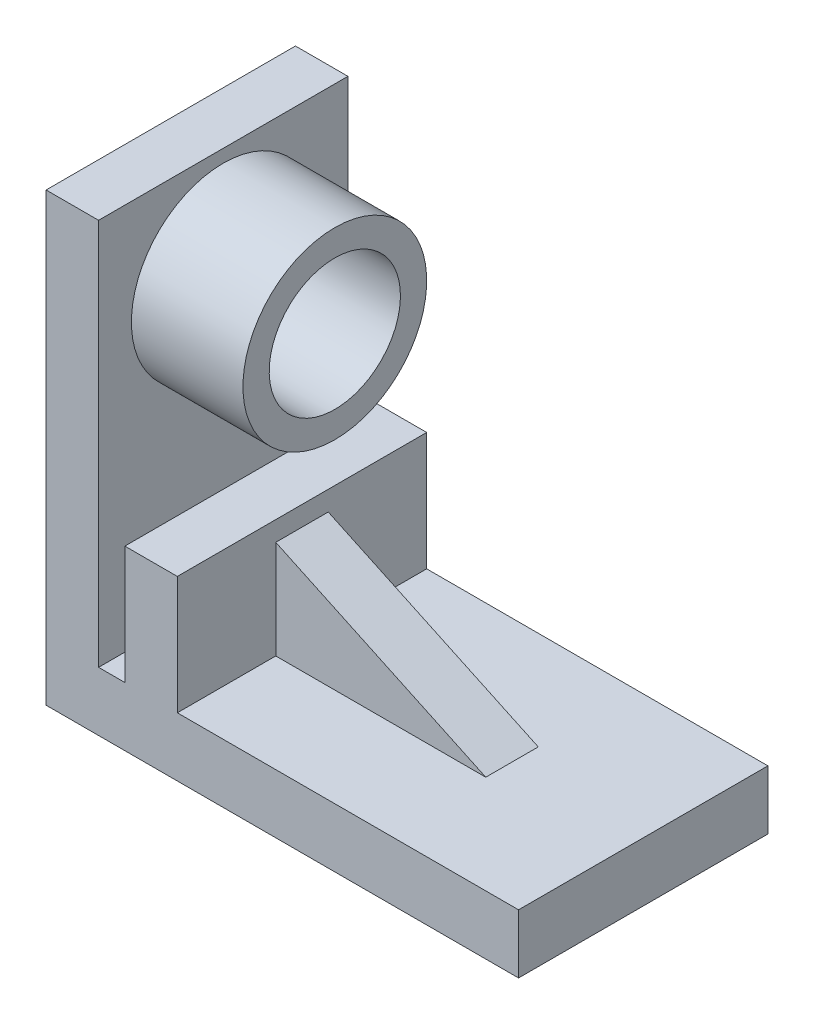
from build123d import *

# Parameters (mm, degrees)
SALIENTE_EXTRUIR2_DEPTH = 19
SALIENTE_EXTRUIR3_DEPTH = 32
CORTAR_EXTRUIR1_DEPTH   = 102.671038157
CROQUIS5_R              = 14
CROQUIS5_R_2            = 10
SALIENTE_EXTRUIR4_DEPTH = 17


with BuildPart() as part:
    # Croquis1 → Saliente-Extruir2 (new, symmetric)
    with BuildSketch(Plane.XY):
        Polygon((0, 0), (0, 68), (8, 68), (8, 9), (12, 9), (12, 27), (20, 27), (20, 9), (72, 9), (72, 0), align=None)
    extrude(amount=SALIENTE_EXTRUIR2_DEPTH, both=True)

    # Croquis3 → Saliente-Extruir3 (add)
    with BuildSketch(Plane(origin=(20, 0, 0), x_dir=(0, 0, -1), z_dir=(1, 0, 0))):
        Polygon((0, 9), (-4, 9), (-4, 24), (4, 24), (4, 9), align=None)
    extrude(amount=SALIENTE_EXTRUIR3_DEPTH)

    # Croquis4 → Cortar-Extruir1 (cut, through all)
    with BuildSketch(Plane.XY.offset(4)):
        Polygon((20, 24), (52, 9), (52, 24), align=None)
    extrude(amount=-CORTAR_EXTRUIR1_DEPTH, mode=Mode.SUBTRACT)

    # Croquis5 → Saliente-Extruir4 (add)
    with BuildSketch(Plane(origin=(8, 0, 0), x_dir=(0, 0, -1), z_dir=(1, 0, 0))):
        with Locations(Location((0, 52.035144158, 0), (0, 0, 270))):
            Circle(CROQUIS5_R)
        with Locations(Location((0, 52.035144158, 0), (0, 0, 90))):
            Circle(CROQUIS5_R_2, mode=Mode.SUBTRACT)
    extrude(amount=SALIENTE_EXTRUIR4_DEPTH)


solid = part.part
